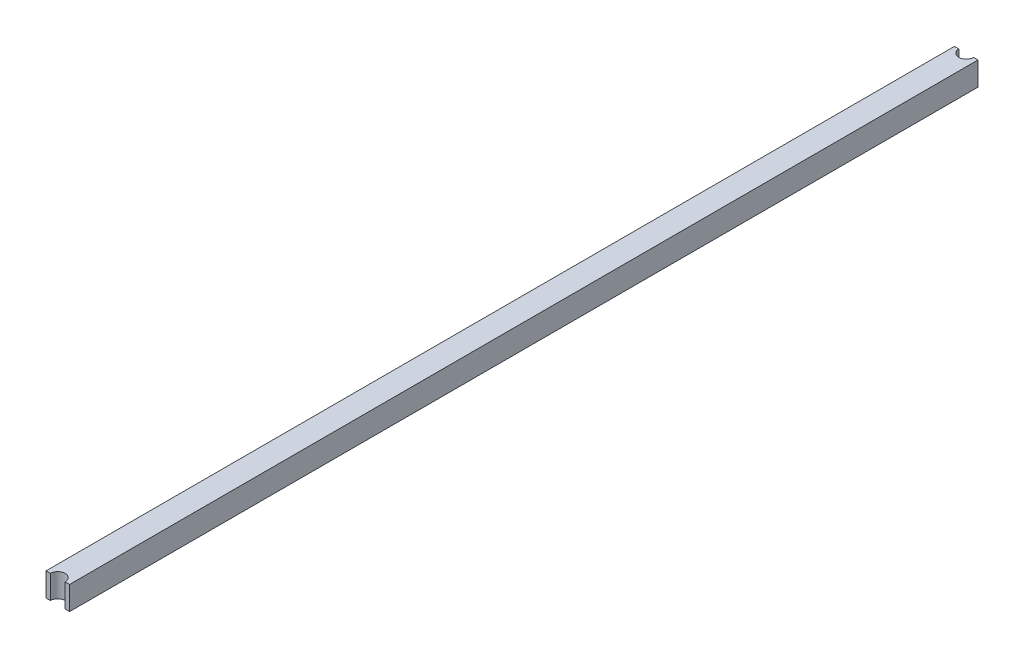
from build123d import *

# Parameters (mm, degrees)
SKETCH2_W           = 31.1
SKETCH2_H           = 31.1
BOSS_EXTRUDE1_DEPTH = 1200
SKETCH4_R           = 9.755
CUT_EXTRUDE1_DEPTH  = 31.1


with BuildPart() as part:
    # Sketch2 → Boss-Extrude1 (new body)
    with BuildSketch(Plane.XY):
        with Locations((-15.55, 15.55)):
            Rectangle(SKETCH2_W, SKETCH2_H)
    extrude(amount=BOSS_EXTRUDE1_DEPTH)

    # Sketch4 → Cut-Extrude1 (cut)
    with BuildSketch(Plane(origin=(0, 31.1, 0), x_dir=(1, 0, 0), z_dir=(0, 1, 0))):
        with Locations((-15.55, -1200)):
            Circle(SKETCH4_R)
        with Locations((-15.55, 0)):
            Circle(SKETCH4_R)
    extrude(amount=-CUT_EXTRUDE1_DEPTH, mode=Mode.SUBTRACT)


solid = part.part
